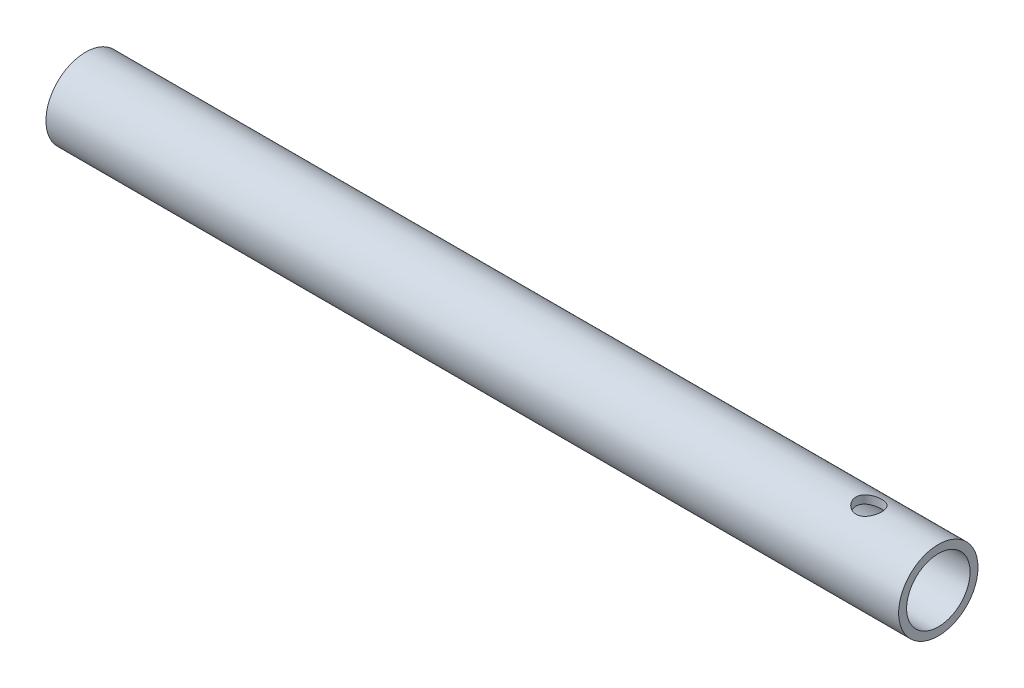
from build123d import *

# Parameters (mm, degrees)
SKETCH1_R           = 20
SKETCH1_R_2         = 16
BOSS_EXTRUDE1_DEPTH = 430
SKETCH2_R           = 6.5
CUT_EXTRUDE1_DEPTH  = 28.5


with BuildPart() as part:
    # Sketch1 → Boss-Extrude1 (new body)
    with BuildSketch(Plane(origin=(0, 0, 0), x_dir=(0, 0, -1), z_dir=(1, 0, 0))):
        Circle(SKETCH1_R)
        Circle(SKETCH1_R_2, mode=Mode.SUBTRACT)
    extrude(amount=-BOSS_EXTRUDE1_DEPTH)

    # Sketch2 → Cut-Extrude1 (cut, symmetric)
    with BuildSketch(Plane(origin=(0, 0, 0), x_dir=(1, 0, 0), z_dir=(0, 1, 0))):
        with Locations(Location((-35, 0, 0), (0, 0, 270))):
            Circle(SKETCH2_R)
    extrude(amount=CUT_EXTRUDE1_DEPTH, both=True, mode=Mode.SUBTRACT)


solid = part.part
